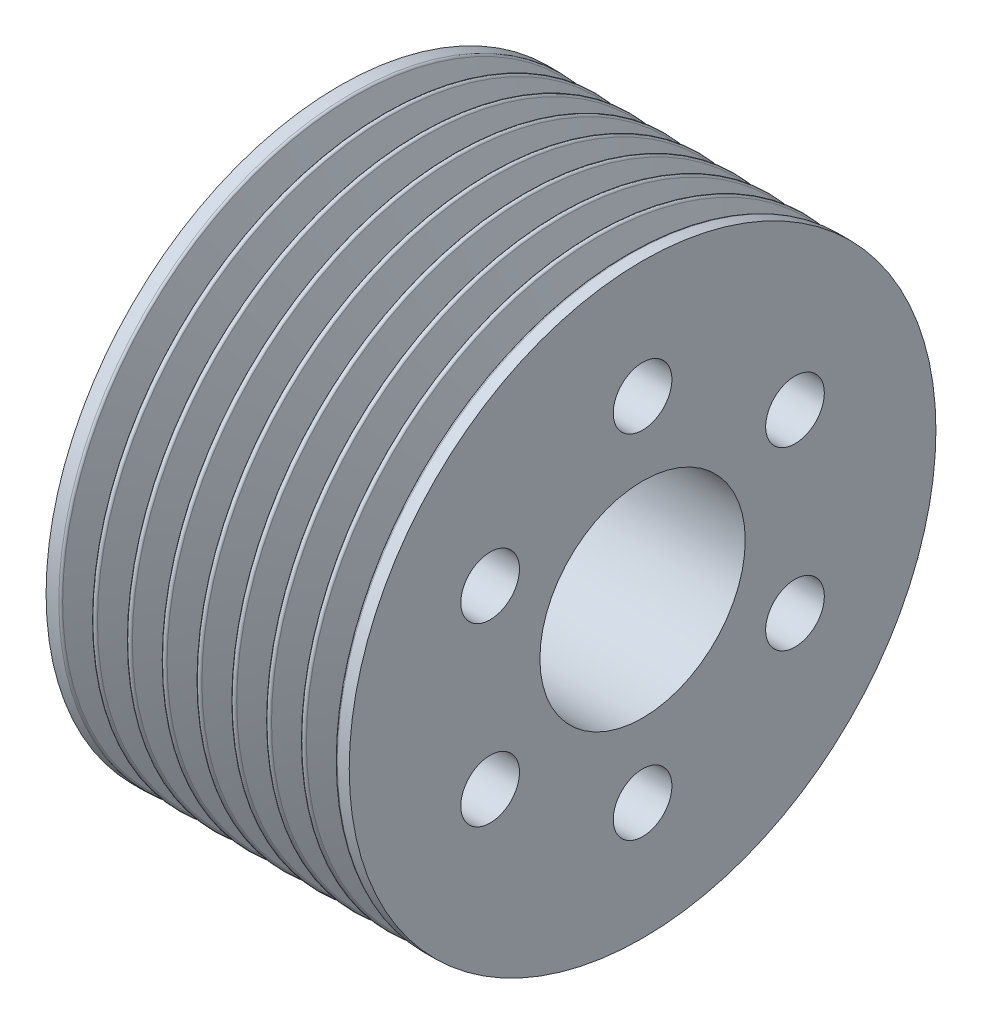
from build123d import *

# Parameters (mm, degrees)
LPATTERN1_COUNT    = 8
LPATTERN1_PITCH    = 3.56
SKETCH3_R          = 3
CUT_EXTRUDE1_DEPTH = 17.5


with BuildPart() as part:
    # Sketch1 → Revolve1 (revolve)
    with BuildSketch(Plane.XY, mode=Mode.PRIVATE) as revolve1_sk:
        Polygon((49, 10.5), (49, 30), (18, 30), (18, 21.5), (31.5, 21.5), (31.5, 10.5), align=None)
    revolve(revolve1_sk.sketch.rotate(Axis((0, 0, 0), (1, 0, 0)), 90), axis=Axis((0, 0, 0), (1, 0, 0)))

    # Sketch2 → Cut-Revolve1 (revolve, cut)
    with BuildSketch(Plane.XY, mode=Mode.PRIVATE) as cut_revolve1_sk:
        with BuildLine():
            Line((47.545831953, 29.837551845), (46.281001657, 26.45460955))
            ThreePointArc((46.281001657, 26.45460955), (46, 26.259671764), (45.718998343, 26.45460955))
            Line((45.718998343, 26.45460955), (44.454168047, 29.837551845))
            ThreePointArc((44.454168047, 29.837551845), (44.362499191, 29.955411734), (44.22, 30))
            Line((44.22, 30), (47.78, 30))
            ThreePointArc((47.78, 30), (47.637500809, 29.955411734), (47.545831953, 29.837551845))
        make_face()
    cut_revolve1 = revolve(cut_revolve1_sk.sketch.rotate(Axis((0, 0, 0), (1, 0, 0)), 90), axis=Axis((0, 0, 0), (1, 0, 0)), mode=Mode.SUBTRACT)

    # LPattern1: Cut-Revolve1 ×8
    with Locations(*[(-i * LPATTERN1_PITCH, 0, 0) for i in range(1, LPATTERN1_COUNT)]):
        add(cut_revolve1, mode=Mode.SUBTRACT)

    # Sketch3 → Cut-Extrude1 (cut)
    with BuildSketch(Plane(origin=(49, 0, 0), x_dir=(0, 0, -1), z_dir=(1, 0, 0))):
        with Locations((0, 18)):
            Circle(SKETCH3_R)
        with Locations((15.588457268, 9)):
            Circle(SKETCH3_R)
        with Locations((15.588457268, -9)):
            Circle(SKETCH3_R)
        with Locations((0, -18)):
            Circle(SKETCH3_R)
        with Locations((-15.588457268, -9)):
            Circle(SKETCH3_R)
        with Locations((-15.588457268, 9)):
            Circle(SKETCH3_R)
    extrude(amount=-CUT_EXTRUDE1_DEPTH, mode=Mode.SUBTRACT)


solid = part.part
